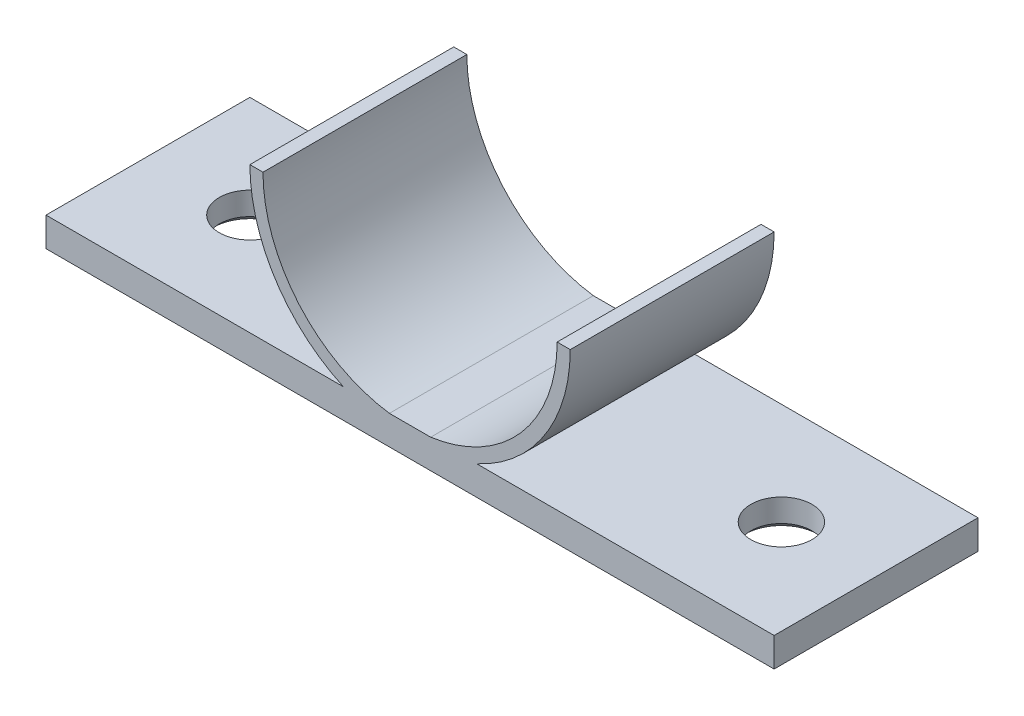
from build123d import *

# Parameters (mm, degrees)
SKETCH_1_W                   = 50
SKETCH_1_H                   = 14
EXTRUDE_1_DEPTH              = 2
EXTRUDE_2_DEPTH              = 14
HOLE_WIZARD_M5_3_D           = 4.2
HOLE_WIZARD_M5_3_DEPTH       = 12.4
HOLE_WIZARD_M5_3_CSINK_D     = 5.05
HOLE_WIZARD_M5_3_CSINK_ANGLE = 90
HOLE_WIZARD_M5_3_TIP         = 1.2618073


with BuildPart() as part:
    # 草图1 → 凸台-拉伸1 (new body)
    with BuildSketch(Plane(origin=(0, 0, 0), x_dir=(1, 0, 0), z_dir=(0, 1, 0))):
        with Locations((25, 7)):
            Rectangle(SKETCH_1_W, SKETCH_1_H)
    extrude(amount=EXTRUDE_1_DEPTH)

    # 草图5 → 凸台-拉伸2 (add)
    with BuildSketch(Plane.XY):
        with BuildLine():
            Line((20.417424305, 2), (23.582255312, 2))
            ThreePointArc((23.582255312, 2), (17.373427331, 5.378414893), (14.9, 12))
            Line((14.9, 12), (14, 12))
            ThreePointArc((14, 12), (15.742345528, 6.058970318), (20.417424305, 2))
        make_face()
        with BuildLine():
            Line((36, 12), (35.1, 12))
            ThreePointArc((35.1, 12), (32.626572669, 5.378414893), (26.417744688, 2))
            Line((26.417744688, 2), (29.582575695, 2))
            ThreePointArc((29.582575695, 2), (34.257654472, 6.058970318), (36, 12))
        make_face()
    extrude(amount=-EXTRUDE_2_DEPTH)

    # M5 螺纹孔3
    with Locations(Plane.XZ):
        with Locations((43.5, -7), (7, -7)):
            CounterSinkHole(HOLE_WIZARD_M5_3_D / 2, HOLE_WIZARD_M5_3_CSINK_D / 2, depth=HOLE_WIZARD_M5_3_DEPTH, counter_sink_angle=HOLE_WIZARD_M5_3_CSINK_ANGLE)
            with Locations((0, 0, -(HOLE_WIZARD_M5_3_DEPTH + HOLE_WIZARD_M5_3_TIP / 2))):  # 118° drill point
                Cone(0, HOLE_WIZARD_M5_3_D / 2, HOLE_WIZARD_M5_3_TIP, mode=Mode.SUBTRACT)


solid = part.part
